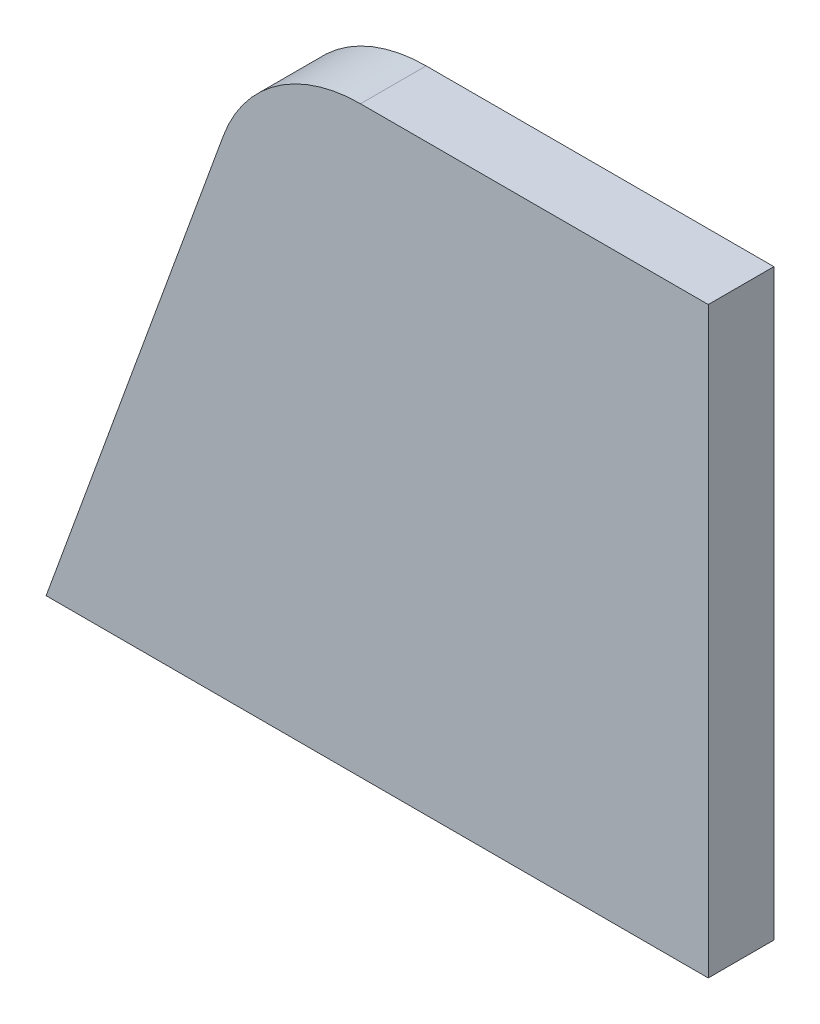
from build123d import *

# Parameters (mm, degrees)
BOSS_EXTRUDE1_DEPTH = 180


with BuildPart() as part:
    # Sketch1 → Boss-Extrude1 (new body)
    with BuildSketch(Plane.XY):
        with BuildLine():
            Line((-304.79726455, 1312.605548325), (-791.355120445, -24.201174005))
            Line((-791.355120445, -24.201174005), (1025.024879555, -24.201174005))
            Line((1025.024879555, -24.201174005), (1025.024879555, 1575.798825995))
            Line((1025.024879555, 1575.798825995), (71.080269662, 1575.798825995))
            ThreePointArc((71.080269662, 1575.798825995), (-158.350886753, 1503.459236276), (-304.79726455, 1312.605548325))
        make_face()
    extrude(amount=BOSS_EXTRUDE1_DEPTH)


solid = part.part
